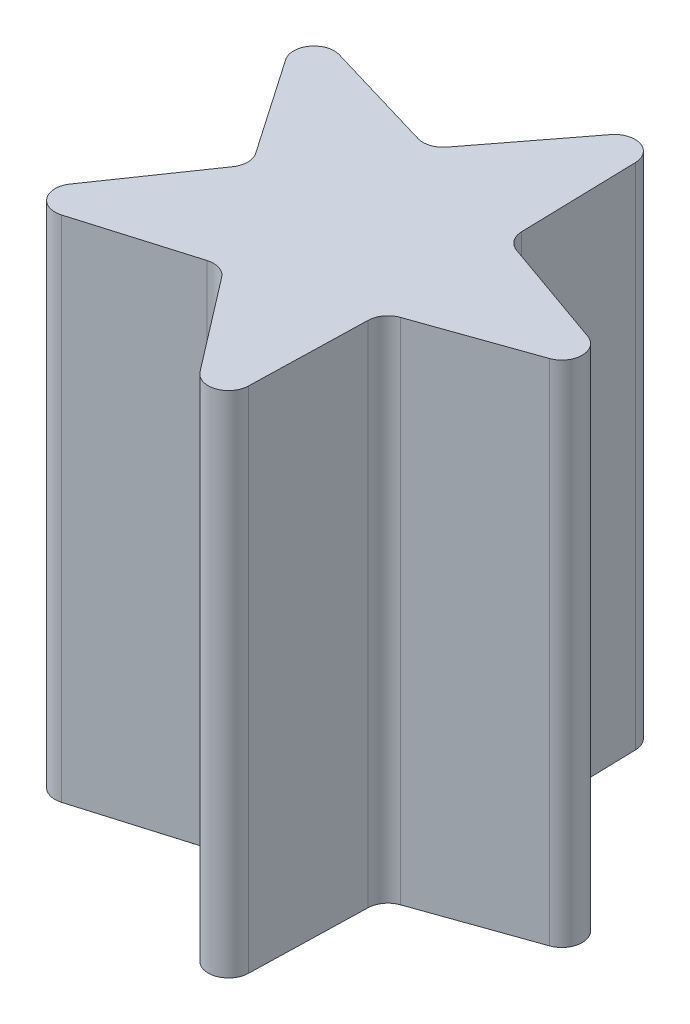
from build123d import *

# Parameters (mm, degrees)
BOSS_EXTRUDE2_DEPTH      = 63.5
BOSS_EXTRUDE2_DEPTH_BACK = 0.000100076
FILLET2_R                = 2.54


with BuildPart() as part:
    # Sketch2 → Boss-Extrude2 (new, two sides: drawn at the far end of the back side and taken through both)
    with BuildSketch(Plane(origin=(0, 0, 0), x_dir=(1, 0, 0), z_dir=(0, 1, 0)).offset(-BOSS_EXTRUDE2_DEPTH_BACK)):
        Polygon((7.336319495, 7.83629969), (7.336319495, 0), (29.508870684, 0), align=None)
        Polygon((29.508870684, 0), (7.336319495, 0), (7.336319495, -7.83629969), align=None)
        Polygon((7.336319495, 0), (-3.449421721, 0), (-0.116444388, -10.257849467), (7.336319495, -7.83629969), align=None)
        Polygon((-0.116444388, 10.257849467), (-3.449421721, 0), (7.336319495, 0), (7.336319495, 7.83629969), align=None)
        Polygon((-12.175269662, 6.339699622), (-3.449421721, 0), (-0.116444388, 10.257849467), (-7.569208272, 12.679399244), align=None)
        Polygon((-12.175269662, -6.339699622), (-3.449421721, 0), (-12.175269662, 6.339699622), (-16.781331052, 0), align=None)
        Polygon((-0.116444388, -10.257849467), (-3.449421721, 0), (-12.175269662, -6.339699622), (-7.569208272, -12.679399244), align=None)
        Polygon((6.735250738, -31.345198758), (-0.116444388, -10.257849467), (-7.569208272, -12.679399244), align=None)
        Polygon((7.336319495, -7.83629969), (-0.116444388, -10.257849467), (6.735250738, -31.345198758), align=None)
        Polygon((-7.569208272, -12.679399244), (-12.175269662, -6.339699622), (-30.113240383, -19.372398217), align=None)
        Polygon((-30.113240383, -19.372398217), (-12.175269662, -6.339699622), (-16.781331052, 0), align=None)
        Polygon((-16.781331052, 0), (-12.175269662, 6.339699622), (-30.113240383, 19.372398217), align=None)
        Polygon((-30.113240383, 19.372398217), (-12.175269662, 6.339699622), (-7.569208272, 12.679399244), align=None)
        Polygon((-7.569208272, 12.679399244), (-0.116444388, 10.257849467), (6.735250738, 31.345198758), align=None)
        Polygon((6.735250738, 31.345198758), (-0.116444388, 10.257849467), (7.336319495, 7.83629969), align=None)
    extrude(amount=BOSS_EXTRUDE2_DEPTH + BOSS_EXTRUDE2_DEPTH_BACK)

    # Fillet2
    fillet2_edges = [part.edges().sort_by_distance(p)[0] for p in [
        (-16.781331052, 31.749949962, 0),
        (-30.113240383, 31.749949962, -19.372398217),
        (-7.569208272, 31.749949962, -12.679399244),
        (6.735250738, 31.749949962, -31.345198758),
        (7.336319495, 31.749949962, -7.83629969),
        (29.508870684, 31.749949962, 0),
        (7.336319495, 31.749949962, 7.83629969),
        (6.735250738, 31.749949962, 31.345198758),
        (-7.569208272, 31.749949962, 12.679399244),
        (-30.113240383, 31.749949962, 19.372398217),
    ]]
    fillet(fillet2_edges, radius=FILLET2_R)


solid = part.part
